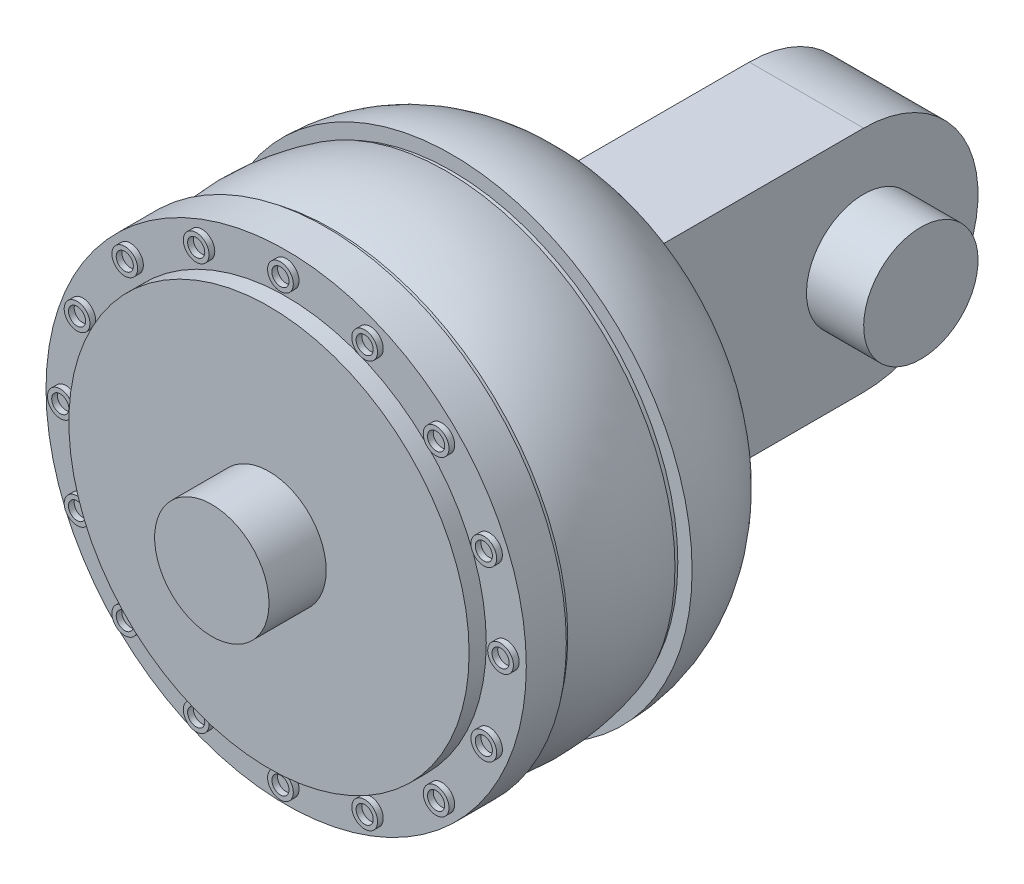
from build123d import *

# Parameters (mm, degrees)
SKETCH2_R           = 39.5
BOSS_EXTRUDE1_DEPTH = 1
SKETCH4_R           = 41.25
BOSS_EXTRUDE2_DEPTH = 1
SKETCH5_R           = 42
BOSS_EXTRUDE3_DEPTH = 7
SKETCH6_R           = 35
BOSS_EXTRUDE4_DEPTH = 3
SKETCH7_R           = 2.25
SKETCH7_R_2         = 1.5
BOSS_EXTRUDE5_DEPTH = 1
CIRPATTERN1_COUNT   = 16
SKETCH8_W           = 20
SKETCH8_H           = 40
BOSS_EXTRUDE6_DEPTH = 42
SKETCH9_R           = 20
BOSS_EXTRUDE7_DEPTH = 20
SKETCH10_R          = 10
BOSS_EXTRUDE8_DEPTH = 10
SKETCH11_R          = 10
BOSS_EXTRUDE9_DEPTH = 10


with BuildPart() as part:
    # Sketch1 → Revolve1 (revolve)
    with BuildSketch(Plane(origin=(0, 0, 0), x_dir=(1, 0, 0), z_dir=(0, 1, 0))):
        with BuildLine():
            Line((0, 0), (0, -20))
            Line((0, -20), (-42, -20))
            ThreePointArc((-42, -20), (-39.360679775, -8.819660113), (-32, 0))
            Line((-32, 0), (0, 0))
        make_face()
    revolve(axis=Axis((0, 0, 0), (0, 0, 1)))

    # Sketch2 → Boss-Extrude1 (add)
    with BuildSketch(Plane.XY.offset(20)):
        Circle(SKETCH2_R)
    extrude(amount=BOSS_EXTRUDE1_DEPTH)

    # Sketch3 → Revolve2 (revolve)
    with BuildSketch(Plane(origin=(0, 0, 0), x_dir=(1, 0, 0), z_dir=(0, 1, 0))):
        with BuildLine():
            Line((0, -21), (-40, -21))
            ThreePointArc((-40, -21), (-41.376973739, -31), (-40, -41))
            Line((-40, -41), (0, -41))
            Line((0, -41), (0, -21))
        make_face()
    revolve(axis=Axis((0, 0, 21), (0, 0, 1)))

    # Sketch4 → Boss-Extrude2 (add)
    with BuildSketch(Plane.XY.offset(41)):
        Circle(SKETCH4_R)
    extrude(amount=BOSS_EXTRUDE2_DEPTH)

    # Sketch5 → Boss-Extrude3 (add)
    with BuildSketch(Plane.XY.offset(42)):
        Circle(SKETCH5_R)
    extrude(amount=BOSS_EXTRUDE3_DEPTH)

    # Sketch6 → Boss-Extrude4 (add)
    with BuildSketch(Plane.XY.offset(49)):
        Circle(SKETCH6_R)
    extrude(amount=BOSS_EXTRUDE4_DEPTH)

    # Sketch7 → Boss-Extrude5 (add)
    with BuildSketch(Plane.XY.offset(49)):
        with Locations((38.5, 0)):
            Circle(SKETCH7_R)
        with Locations((38.5, 0)):
            Circle(SKETCH7_R_2, mode=Mode.SUBTRACT)
    boss_extrude5 = extrude(amount=BOSS_EXTRUDE5_DEPTH)

    # CirPattern1: Boss-Extrude5 ×16 about axis
    cirpattern1_axis = Axis((0, 0, 0), (0, 0, 1))
    for i in range(1, CIRPATTERN1_COUNT):
        add(boss_extrude5.rotate(cirpattern1_axis, i * 360 / CIRPATTERN1_COUNT))

    # Sketch8 → Boss-Extrude6 (add)
    with BuildSketch(Plane(origin=(0, 0, 0), x_dir=(-1, 0, 0), z_dir=(0, 0, -1))):
        Rectangle(SKETCH8_W, SKETCH8_H)
    extrude(amount=BOSS_EXTRUDE6_DEPTH)

    # Sketch9 → Boss-Extrude7 (add)
    with BuildSketch(Plane.ZY.offset(10)):
        with Locations((-42, 0)):
            Circle(SKETCH9_R)
    extrude(amount=-BOSS_EXTRUDE7_DEPTH)

    # Sketch10 → Boss-Extrude8 (add)
    with BuildSketch(Plane.ZY.offset(10)):
        with Locations(Location((-42, 0, 0), (0, 0, 90))):
            Circle(SKETCH10_R)
    boss_extrude8 = extrude(amount=BOSS_EXTRUDE8_DEPTH)

    # Sketch11 → Boss-Extrude9 (add)
    with BuildSketch(Plane.XY.offset(52)):
        Circle(SKETCH11_R)
    extrude(amount=BOSS_EXTRUDE9_DEPTH)

    # Mirror1: Boss-Extrude8 across plane
    add(boss_extrude8.mirror(Plane(origin=(0, 0, 0), x_dir=(0, 0, 1), z_dir=(1, 0, 0))))


solid = part.part
